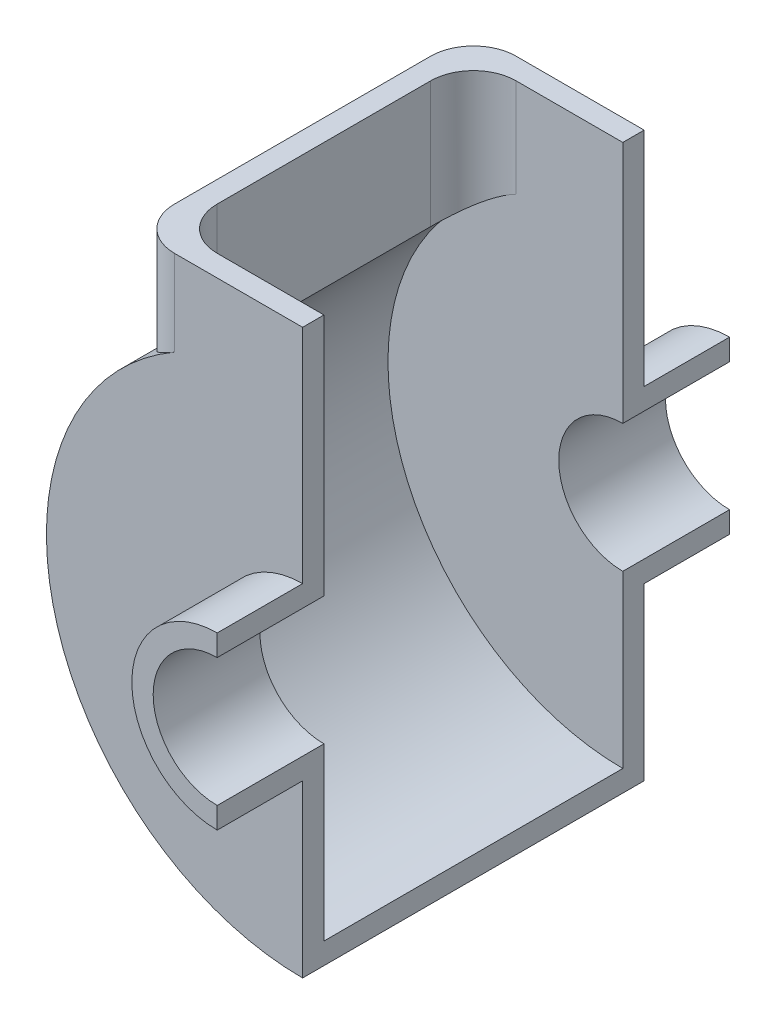
from build123d import *

# Parameters (mm, degrees)
DODANIE_WYCI_GNI_CIE1_DEPTH       = 25
DODANIE_WYCI_GNI_CIE2_DEPTH       = 5
WYCI_GNI_CIE_CIENKA_CIANKA1_REACH = 135.45
ZAOKR_GLENIE3_R                   = 10
ZAOKR_GLENIE4_R                   = 10


with BuildPart() as part:
    # Szkic1 → Dodanie-wyciągnięcie1 (new body)
    with BuildSketch(Plane.XY):
        with BuildLine():
            Line((0, 15), (0, 20))
            ThreePointArc((0, 20), (-20, 0), (0, -20))
            Line((0, -20), (0, -15))
            ThreePointArc((0, -15), (-15, 0), (0, 15))
        make_face()
    extrude(amount=DODANIE_WYCI_GNI_CIE1_DEPTH)

    # Szkic3 → Dodanie-wyciągnięcie2 (add)
    with BuildSketch(Plane.XY):
        with BuildLine():
            Line((0, 20), (0, 72))
            Line((0, 72), (-40, 72))
            Line((-40, 72), (-40, 44.72135955))
            ThreePointArc((-40, 44.72135955), (-56.050341538, -21.409325386), (0, -60))
            Line((0, -60), (0, -20))
            ThreePointArc((0, -20), (-20, 0), (0, 20))
        make_face()
    extrude(amount=DODANIE_WYCI_GNI_CIE2_DEPTH)


with BuildPart() as body_2:
    # Lustro2: mirrored copy
    add(part.part.mirror(Plane(origin=(0, 0, -35), x_dir=(1, 0, 0), z_dir=(0, 0, -1))))

    # Szkic6 → Wyciągnięcie-cienka ścianka1 (add, up to next)
    with BuildSketch(Plane(origin=(0, 0, 0), x_dir=(-1, 0, 0), z_dir=(0, 0, -1)), mode=Mode.PRIVATE) as wyci_gni_cie_cienka_cianka1_sk1:
        with BuildLine():
            Line((40, 72), (40, 44.72135955))
            ThreePointArc((40, 44.72135955), (56.050341538, -21.409325386), (0, -60))
            Line((0, -60), (0, -55))
            ThreePointArc((0, -55), (51.76124215, -18.594994247), (35, 42.426406871))
            Line((35, 42.426406871), (35, 72))
            Line((35, 72), (40, 72))
        make_face()
    wyci_gni_cie_cienka_cianka1_tool1 = extrude(wyci_gni_cie_cienka_cianka1_sk1.sketch, amount=WYCI_GNI_CIE_CIENKA_CIANKA1_REACH, mode=Mode.PRIVATE) - body_2.part

    add(part.part)  # Wyciągnięcie-cienka ścianka1 merges part
    add(wyci_gni_cie_cienka_cianka1_tool1.solids().sort_by_distance((-38.550034, 58.36068, 0))[0])

    # Zaokrąglenie3
    zaokr_glenie3_edges = [body_2.edges().sort_by_distance(p)[0] for p in [
        (-40, 58.360679775, -75),
        (-40, 58.360679775, 5),
    ]]
    fillet(zaokr_glenie3_edges, radius=ZAOKR_GLENIE3_R)

    # Zaokrąglenie4
    zaokr_glenie4_edges = [body_2.edges().sort_by_distance(p)[0] for p in [
        (-35, 57.213203436, 0),
        (-35, 57.213203436, -70),
    ]]
    fillet(zaokr_glenie4_edges, radius=ZAOKR_GLENIE4_R)


solid = body_2.part
